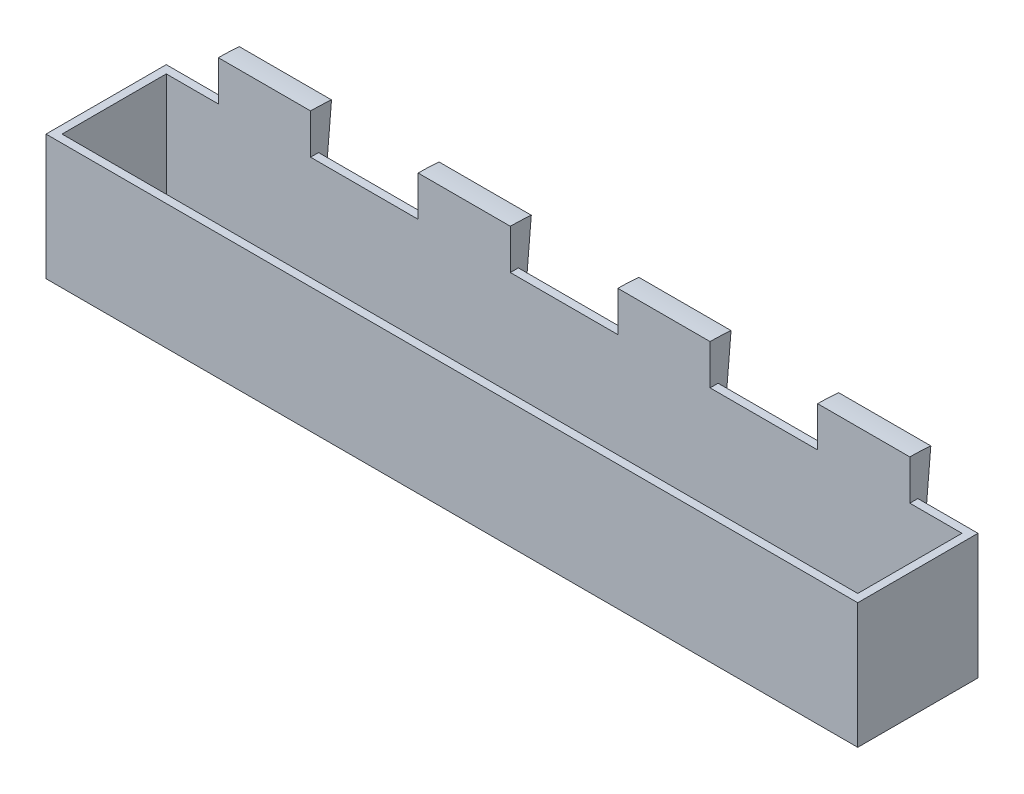
from build123d import *

# Parameters (mm, degrees)
SKETCH1_W           = 514.35
SKETCH1_H           = 76.2
SKETCH1_W_2         = 504.19
SKETCH1_H_2         = 66.04
BOSS_EXTRUDE1_DEPTH = 76.2
REVOLVE1_ANGLE      = 5
SKETCH3_W           = 38.1
SKETCH3_H           = 15.24
BOSS_EXTRUDE2_DEPTH = 5.08
SKETCH4_W           = 514.35
SKETCH4_H           = 76.2
BOSS_EXTRUDE3_DEPTH = 3.175


with BuildPart() as part:
    # Sketch1 → Boss-Extrude1 (new body)
    with BuildSketch(Plane(origin=(0, 0, 0), x_dir=(1, 0, 0), z_dir=(0, 1, 0))):
        Rectangle(SKETCH1_W, SKETCH1_H)
        Rectangle(SKETCH1_W_2, SKETCH1_H_2, mode=Mode.SUBTRACT)
    extrude(amount=BOSS_EXTRUDE1_DEPTH)

    # Sketch2 → Revolve1 (revolve)
    with BuildSketch(Plane(origin=(0, 0, -33.02), x_dir=(-1, 0, 0), z_dir=(0, 0, -1))):
        Polygon((-219.075, 12.7), (-219.075, 101.6), (-160.655, 101.6), (-160.655, 12.7), (-170.815, 12.7), (-170.815, 91.44), (-208.915, 91.44), (-208.915, 12.7), align=None)
        Polygon((-82.338333333, 12.7), (-92.498333333, 12.7), (-92.498333333, 101.6), (-34.078333333, 101.6), (-34.078333333, 12.7), (-44.238333333, 12.7), (-44.238333333, 91.44), (-82.338333333, 91.44), align=None)
        Polygon((44.238333333, 12.7), (34.078333333, 12.7), (34.078333333, 101.6), (92.498333333, 101.6), (92.498333333, 12.7), (82.338333333, 12.7), (82.338333333, 91.44), (44.238333333, 91.44), align=None)
        Polygon((170.815, 12.7), (160.655, 12.7), (160.655, 101.6), (219.075, 101.6), (219.075, 12.7), (208.915, 12.7), (208.915, 91.44), (170.815, 91.44), align=None)
    revolve(axis=Axis((275.97212821, -50.8, -33.02), (-1, 0, 0)), revolution_arc=REVOLVE1_ANGLE)

    # Sketch3 → Boss-Extrude2 (add)
    with BuildSketch(Plane.XY.offset(-33.02)):
        with Locations((-189.865, 83.82)):
            Rectangle(SKETCH3_W, SKETCH3_H)
        with Locations((-63.288333333, 83.82)):
            Rectangle(SKETCH3_W, SKETCH3_H)
        with Locations((63.288333333, 83.82)):
            Rectangle(SKETCH3_W, SKETCH3_H)
        with Locations((189.865, 83.82)):
            Rectangle(SKETCH3_W, SKETCH3_H)
    extrude(amount=-BOSS_EXTRUDE2_DEPTH)

    # Sketch4 → Boss-Extrude3 (add)
    with BuildSketch(Plane.XZ):
        Rectangle(SKETCH4_W, SKETCH4_H)
    extrude(amount=BOSS_EXTRUDE3_DEPTH)


solid = part.part
